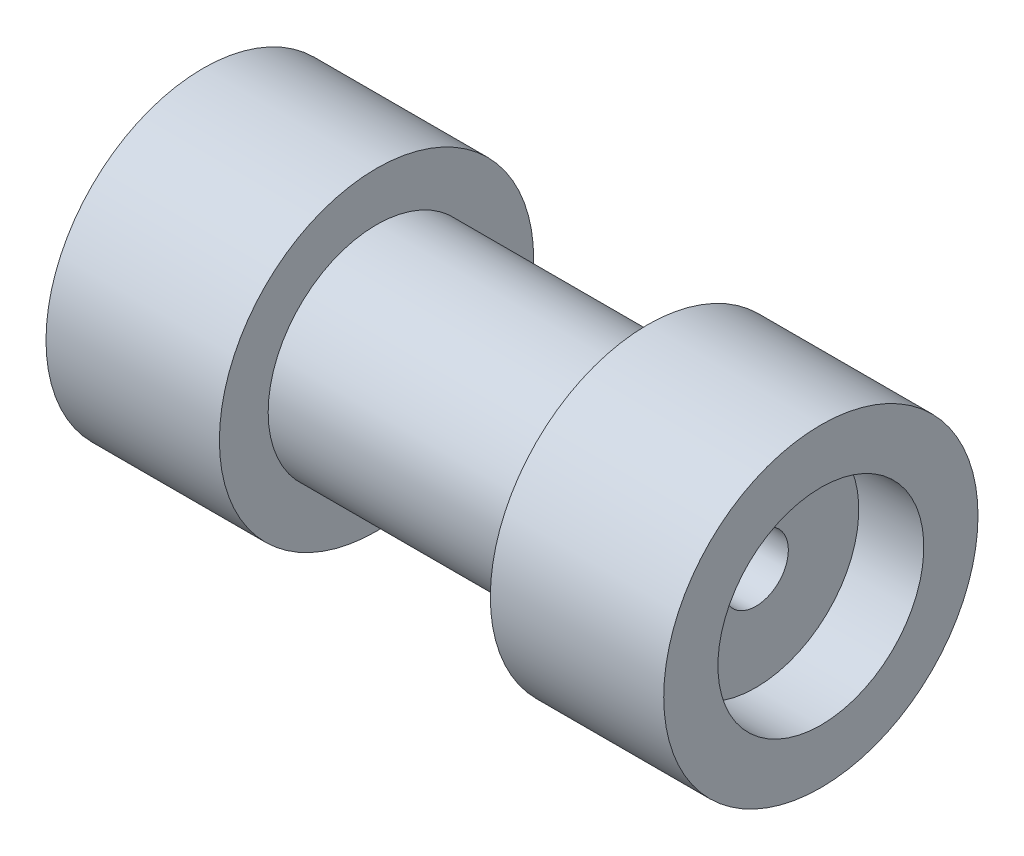
from build123d import *

# Parameters (mm, degrees)
SKETCH2_R          = 3
CUT_EXTRUDE1_DEPTH = 55.968172609


with BuildPart() as part:
    # Sketch1 → Revolve1 (revolve)
    with BuildSketch(Plane.XY, mode=Mode.PRIVATE) as revolve1_sk:
        Polygon((-12.5, 10), (12.5, 10), (12.5, 14.5), (28.5, 14.5), (28.5, 9.5), (22.5, 9.5), (22.5, 0), (-22.5, 0), (-22.5, 9.5), (-28.5, 9.5), (-28.5, 14.5), (-12.5, 14.5), align=None)
    revolve(revolve1_sk.sketch.rotate(Axis((-22.5, 0, 0), (1, 0, 0)), 180), axis=Axis((-22.5, 0, 0), (1, 0, 0)))

    # Sketch2 → Cut-Extrude1 (cut, through all)
    with BuildSketch(Plane.ZY.offset(22.5)):
        with Locations(Location((0, 0, 0), (0, 0, 270))):
            Circle(SKETCH2_R)
    extrude(amount=-CUT_EXTRUDE1_DEPTH, mode=Mode.SUBTRACT)


solid = part.part
